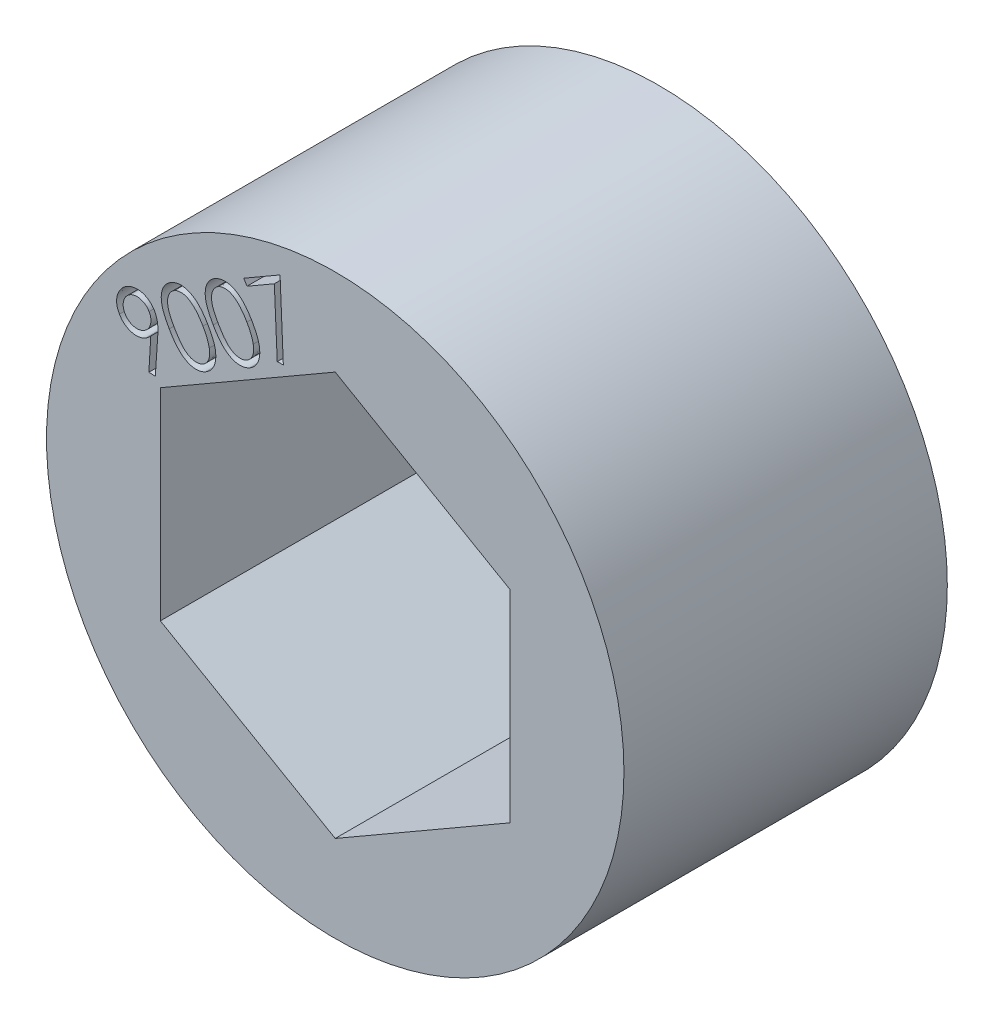
from build123d import *

# Parameters (mm, degrees)
SKETCH1_R           = 11.1125
BOSS_EXTRUDE1_DEPTH = 12.446
CUT_EXTRUDE1_DEPTH  = 2


with BuildPart() as part:
    # Sketch1 → Boss-Extrude1 (new body)
    with BuildSketch(Plane.XY):
        Circle(SKETCH1_R)
        Polygon((6.731, 3.886144662), (0, 7.772289324), (-6.731, 3.886144662), (-6.731, -3.886144662), (0, -7.772289324), (6.731, -3.886144662), align=None, mode=Mode.SUBTRACT)
    extrude(amount=BOSS_EXTRUDE1_DEPTH)

    # Sketch2 → Cut-Extrude1 (cut)
    # profile 1 of 4: a face of its own
    with BuildSketch(Plane.XY.offset(12.446)):
        with BuildLine():
            Line((-6.924573237, 4.169554117), (-7.172365705, 4.181765656))
            Line((-7.172365705, 4.181765656), (-7.099096474, 5.424798508))
            add(Edge.make_bspline(
                [(-7.099096474, 5.424798508), (-7.115082491, 5.407369556), (-7.146178835, 5.373466383), (-7.196679552, 5.328749615), (-7.247249931, 5.28893276), (-7.283061917, 5.267076576), (-7.300586859, 5.25638104)],
                knots=[0, 0, 0, 0, 1.07557127, 2.092224476, 3.066411598, 4, 4, 4, 4], degree=3))
            add(Edge.make_bspline(
                [(-7.300586859, 5.25638104), (-7.322245392, 5.244562458), (-7.365097755, 5.221178871), (-7.432394268, 5.194463627), (-7.500523976, 5.17467734), (-7.5697037, 5.163292848), (-7.639544965, 5.157833849), (-7.710525739, 5.160562601), (-7.782232964, 5.170921978), (-7.854086187, 5.188195988), (-7.924350337, 5.211812561), (-7.991348699, 5.241942907), (-8.054290519, 5.278203693), (-8.112922484, 5.320700807), (-8.167757247, 5.368767428), (-8.218277127, 5.422903097), (-8.264381974, 5.483418603), (-8.291278489, 5.527163849), (-8.304985897, 5.549457963)],
                knots=[0, 0, 0, 0, 1.015135184, 2.008489705, 2.974464217, 3.930823522, 4.890110555, 5.854468119, 6.84900024, 7.868689235, 8.893387844, 9.896732215, 10.888539014, 11.878968029, 12.873598221, 13.886496971, 14.922884625, 16, 16, 16, 16], degree=3))
            add(Edge.make_bspline(
                [(-8.304985897, 5.549457963), (-8.321829372, 5.580937848), (-8.35496852, 5.642873798), (-8.388523348, 5.74147864), (-8.41038059, 5.841169826), (-8.416390713, 5.942269443), (-8.410354933, 6.043160996), (-8.3888868, 6.142193846), (-8.354424656, 6.238857598), (-8.306747334, 6.331822917), (-8.247413823, 6.418819647), (-8.178679286, 6.497913682), (-8.099373913, 6.566649861), (-8.040250165, 6.603786522), (-8.010382532, 6.622546906)],
                knots=[0, 0, 0, 0, 1.035324533, 2.036977218, 3.013660684, 3.991039457, 4.968418229, 5.940283026, 6.923354643, 7.941094773, 8.965736768, 9.974485588, 10.976767849, 12, 12, 12, 12], degree=3))
            add(Edge.make_bspline(
                [(-8.010382532, 6.622546906), (-7.979910899, 6.638850823), (-7.919650887, 6.671093082), (-7.822977976, 6.703912105), (-7.723620108, 6.724036171), (-7.622366935, 6.731027877), (-7.521005812, 6.725244635), (-7.42209833, 6.705076571), (-7.326179688, 6.671818439), (-7.23552206, 6.624246651), (-7.150604524, 6.566583058), (-7.074244034, 6.499137059), (-7.007686175, 6.422178737), (-6.971693304, 6.364911211), (-6.953575641, 6.336084566)],
                knots=[0, 0, 0, 0, 1.019400264, 2.015942902, 3.002372847, 4.006779929, 5.005536382, 5.991966327, 6.979044859, 7.994053264, 9.007032045, 10.004279611, 10.995418019, 12, 12, 12, 12], degree=3))
            add(Edge.make_bspline(
                [(-6.953575641, 6.336084566), (-6.94108065, 6.31272698), (-6.915652645, 6.265192989), (-6.885381609, 6.188386689), (-6.861133323, 6.106084415), (-6.845411218, 6.033562631), (-6.836154063, 5.971895301), (-6.830329714, 5.921683006), (-6.827289712, 5.867998445), (-6.824338922, 5.810852315), (-6.824147449, 5.750433103), (-6.825154461, 5.686480995), (-6.8276696, 5.619128602), (-6.830514546, 5.573027762), (-6.831969071, 5.549457963)],
                knots=[0, 0, 0, 0, 1.179517641, 2.400384276, 3.669978525, 4.99951221, 5.702757638, 6.447991837, 7.250775919, 8.098000084, 8.997311831, 9.942054579, 10.947842213, 12, 12, 12, 12], degree=3))
            Line((-6.831969071, 5.549457963), (-6.924573237, 4.169554117))
        make_face()
        with BuildLine():
            add(Edge.make_bspline(
                [(-7.361135737, 5.478223989), (-7.345487269, 5.487746706), (-7.314754829, 5.50644862), (-7.272925048, 5.539525135), (-7.234809529, 5.575039337), (-7.201759778, 5.61461068), (-7.172554575, 5.656996981), (-7.147610177, 5.702548092), (-7.126426025, 5.751143971), (-7.110705102, 5.802616363), (-7.0986576, 5.855119612), (-7.092896712, 5.907849387), (-7.090958642, 5.959787747), (-7.095079997, 6.011179891), (-7.105043932, 6.061513312), (-7.119192538, 6.111409675), (-7.139177576, 6.16045437), (-7.156127013, 6.191897442), (-7.164733494, 6.207863412)],
                knots=[0, 0, 0, 0, 1.045108442, 2.052516081, 3.039037663, 4.014948609, 4.990090363, 5.974041511, 6.976128051, 8.011453109, 9.043011603, 10.047295345, 11.035574291, 12.007150616, 12.98344593, 13.961229243, 14.964765542, 16, 16, 16, 16], degree=3))
            add(Edge.make_bspline(
                [(-7.164733494, 6.207863412), (-7.174089133, 6.223337647), (-7.192579766, 6.25392117), (-7.225361936, 6.295555785), (-7.261221691, 6.333165381), (-7.300583692, 6.366255071), (-7.343021549, 6.395378721), (-7.388421649, 6.420501289), (-7.437279658, 6.440887199), (-7.48859131, 6.45687647), (-7.541170457, 6.468569984), (-7.59379444, 6.475439698), (-7.645815305, 6.476342459), (-7.697101746, 6.472242177), (-7.747829859, 6.463193366), (-7.797786368, 6.448045864), (-7.847496015, 6.428546419), (-7.87894757, 6.411079557), (-7.894881731, 6.402230399)],
                knots=[0, 0, 0, 0, 1.031712043, 2.039092063, 3.018573684, 3.994457873, 4.969572892, 5.953497063, 6.951758218, 7.98705489, 9.018585102, 10.024008046, 11.012022604, 11.983572292, 12.958061913, 13.947831088, 14.960318852, 16, 16, 16, 16], degree=3))
            add(Edge.make_bspline(
                [(-7.894881731, 6.402230399), (-7.910388278, 6.392913988), (-7.940921187, 6.374569665), (-7.982097239, 6.341251164), (-8.020219854, 6.305954392), (-8.053196364, 6.26632484), (-8.082544826, 6.224113666), (-8.106768331, 6.178261226), (-8.128105712, 6.129841495), (-8.143774813, 6.078340812), (-8.155836626, 6.025845148), (-8.161573927, 5.973282237), (-8.163530138, 5.921515103), (-8.159407983, 5.870292051), (-8.149447912, 5.819958724), (-8.135298263, 5.770062336), (-8.115313509, 5.721017647), (-8.098364033, 5.689574574), (-8.089757532, 5.673608604)],
                knots=[0, 0, 0, 0, 1.034021631, 2.036022986, 3.024725885, 4.002794686, 4.980092595, 5.961574923, 6.965877195, 8.00349148, 9.037330872, 10.043835206, 11.024597356, 11.998321951, 12.97677597, 13.956721278, 14.962476515, 16, 16, 16, 16], degree=3))
            add(Edge.make_bspline(
                [(-8.089757532, 5.673608604), (-8.080402299, 5.658133752), (-8.061912467, 5.627549009), (-8.029124446, 5.585923294), (-7.993286198, 5.548280986), (-7.953951832, 5.515402013), (-7.911936753, 5.485891939), (-7.866435331, 5.461124337), (-7.817859582, 5.439909893), (-7.766381593, 5.424197392), (-7.713879847, 5.412147629), (-7.661149682, 5.406387328), (-7.609211423, 5.404449106), (-7.557819252, 5.4085705), (-7.507485838, 5.418534425), (-7.457589474, 5.432683034), (-7.408544779, 5.452668071), (-7.377101707, 5.469617508), (-7.361135737, 5.478223989)],
                knots=[0, 0, 0, 0, 1.033571637, 2.042767394, 3.024014467, 4.001657624, 4.970548117, 5.956245748, 6.96011096, 7.997273687, 9.030663166, 10.03672948, 11.026762591, 12.000063433, 12.97809164, 13.957610489, 14.962928033, 16, 16, 16, 16], degree=3))
        make_face(mode=Mode.SUBTRACT)
    # profile 2 of 4: a face of its own
    with BuildSketch(Plane.XY.offset(12.446)):
        with BuildLine():
            add(Edge.make_bspline(
                [(-6.389027288, 6.017566938), (-6.409133435, 6.05287131), (-6.448236952, 6.121533154), (-6.500873973, 6.223940657), (-6.5479921, 6.321471948), (-6.588289918, 6.414639381), (-6.622135347, 6.503195954), (-6.649104818, 6.587324729), (-6.670478205, 6.66685528), (-6.684728435, 6.74258894), (-6.693459759, 6.815023383), (-6.697441648, 6.88469611), (-6.697696161, 6.952166749), (-6.693111178, 7.017469604), (-6.684045888, 7.080591596), (-6.670272779, 7.141511165), (-6.651816049, 7.200122602), (-6.629460311, 7.256615341), (-6.6032926, 7.310614152), (-6.572189244, 7.360976223), (-6.539018056, 7.4090837), (-6.501460957, 7.453283246), (-6.461212994, 7.495043123), (-6.416749354, 7.532866127), (-6.369393739, 7.568459362), (-6.335448189, 7.58906299), (-6.318302128, 7.599469982)],
                knots=[0, 0, 0, 0, 1.642217524, 3.193873097, 4.653599743, 6.020219012, 7.296149585, 8.484364078, 9.590266645, 10.622995624, 11.596731579, 12.537641419, 13.442669779, 14.322439731, 15.181528583, 16.018162769, 16.844365298, 17.663022962, 18.472528165, 19.266229043, 20.053716379, 20.832379209, 21.608138827, 22.395685855, 23.18965321, 24, 24, 24, 24], degree=3))
            add(Edge.make_bspline(
                [(-6.318302128, 7.599469982), (-6.300474489, 7.609271708), (-6.265131437, 7.628703497), (-6.209787585, 7.652335356), (-6.154045959, 7.672499617), (-6.096960794, 7.687280903), (-6.039102527, 7.697404539), (-5.980071677, 7.703057454), (-5.920188094, 7.704033863), (-5.859484113, 7.700372492), (-5.798152383, 7.692430856), (-5.736739105, 7.678593604), (-5.675517251, 7.65940816), (-5.613945721, 7.636279306), (-5.553264257, 7.606380908), (-5.492313163, 7.572026405), (-5.431183668, 7.533035334), (-5.370608651, 7.487827675), (-5.309343602, 7.437200437), (-5.248722903, 7.379183566), (-5.187834446, 7.314197984), (-5.127591655, 7.241999672), (-5.067536628, 7.162618397), (-5.006762535, 7.076751546), (-4.947049745, 6.983043093), (-4.908357548, 6.917603706), (-4.8885345, 6.884077354)],
                knots=[0, 0, 0, 0, 0.815881076, 1.617473213, 2.411751612, 3.192532544, 3.980223438, 4.766442947, 5.569622482, 6.380892254, 7.204795063, 8.048528362, 8.903143009, 9.777765604, 10.684831081, 11.614241792, 12.584586996, 13.591843045, 14.645331516, 15.771781295, 16.956234458, 18.217113798, 19.542884518, 20.949560407, 22.437178076, 24, 24, 24, 24], degree=3))
            add(Edge.make_bspline(
                [(-4.8885345, 6.884077354), (-4.869530652, 6.850255126), (-4.832467548, 6.784291814), (-4.781234767, 6.686184653), (-4.737228342, 6.591081689), (-4.698597399, 6.499763578), (-4.666653096, 6.411920287), (-4.640306006, 6.327614929), (-4.620396404, 6.246737064), (-4.6063935, 6.169055221), (-4.598603188, 6.094211015), (-4.593971274, 6.022202966), (-4.595400477, 5.952523966), (-4.599979685, 5.885128312), (-4.610491525, 5.820080305), (-4.624506818, 5.757237794), (-4.643374509, 5.696973407), (-4.666941719, 5.639407798), (-4.694183707, 5.584543463), (-4.725674846, 5.533004056), (-4.759484853, 5.483999185), (-4.797252883, 5.438330896), (-4.839447463, 5.396814623), (-4.883987575, 5.35750714), (-4.93219409, 5.321382207), (-4.966703412, 5.300529969), (-4.984191551, 5.289962771)],
                knots=[0, 0, 0, 0, 1.558572261, 3.039675171, 4.44500239, 5.767404933, 7.021920233, 8.19867626, 9.314183841, 10.366093107, 11.366862767, 12.335955634, 13.262731656, 14.164729598, 15.047477431, 15.907015182, 16.749641984, 17.580952634, 18.403702246, 19.207672054, 20.005351578, 20.794016824, 21.584181799, 22.380929523, 23.179510693, 24, 24, 24, 24], degree=3))
            add(Edge.make_bspline(
                [(-4.984191551, 5.289962771), (-5.001707815, 5.280398375), (-5.036487948, 5.261407397), (-5.090424565, 5.237293305), (-5.145760575, 5.218713906), (-5.201565282, 5.203563548), (-5.258522917, 5.194204812), (-5.316138998, 5.188366749), (-5.374836605, 5.187510596), (-5.434253982, 5.19085035), (-5.493895069, 5.199844146), (-5.553639391, 5.212682554), (-5.612762156, 5.232078045), (-5.672049751, 5.255375395), (-5.731144466, 5.284104522), (-5.790200814, 5.31763903), (-5.848795364, 5.35668413), (-5.907832517, 5.400497199), (-5.966485881, 5.451344089), (-6.025807257, 5.50924311), (-6.085659079, 5.574770443), (-6.145595752, 5.648407462), (-6.206315193, 5.729467377), (-6.266921655, 5.818563605), (-6.328918742, 5.914869108), (-6.368587219, 5.982644272), (-6.389027288, 6.017566938)],
                knots=[0, 0, 0, 0, 0.807491903, 1.603348545, 2.386916451, 3.167713854, 3.940658363, 4.719915701, 5.50935356, 6.313835313, 7.125313705, 7.947948844, 8.783651521, 9.640150085, 10.524255013, 11.440287308, 12.386399569, 13.372019105, 14.413529699, 15.525036669, 16.724996316, 18.002813491, 19.365932914, 20.822335035, 22.362637201, 24, 24, 24, 24], degree=3))
        make_face()
        with BuildLine():
            add(Edge.make_bspline(
                [(-6.178887064, 6.133067739), (-6.161426429, 6.103110337), (-6.127615012, 6.045099717), (-6.075562681, 5.962541829), (-6.024679761, 5.886803909), (-5.975569273, 5.817418966), (-5.927311523, 5.755166928), (-5.879859047, 5.700199785), (-5.834156819, 5.65148208), (-5.789064755, 5.609378951), (-5.744235972, 5.572833103), (-5.699427311, 5.540619065), (-5.654149077, 5.512669859), (-5.608806841, 5.488586996), (-5.563034266, 5.468596404), (-5.517073037, 5.452114899), (-5.470451641, 5.440634387), (-5.40939359, 5.4296989), (-5.334415628, 5.425511888), (-5.247777632, 5.434167276), (-5.165788161, 5.45555361), (-5.1162741, 5.480855148), (-5.091551326, 5.493488412)],
                knots=[0, 0, 0, 0, 1.475228016, 2.856686104, 4.15161897, 5.357081144, 6.47289893, 7.501387829, 8.445726694, 9.313720896, 10.124066195, 10.905058304, 11.660046733, 12.386348828, 13.08755313, 13.783651734, 14.460982071, 15.127735434, 16.421461315, 17.639985157, 18.821625413, 20, 20, 20, 20], degree=3))
            add(Edge.make_bspline(
                [(-5.091551326, 5.493488412), (-5.068050045, 5.508642633), (-5.021313431, 5.538779584), (-4.961478465, 5.598510023), (-4.911472366, 5.668409922), (-4.878039915, 5.734188546), (-4.85741428, 5.791297255), (-4.844382179, 5.836586753), (-4.836028368, 5.884173817), (-4.830714321, 5.933481805), (-4.830160258, 5.98468181), (-4.831895448, 6.037724108), (-4.838141277, 6.092619979), (-4.844899008, 6.129541753), (-4.848338185, 6.148332162)],
                knots=[0, 0, 0, 0, 1.342886321, 2.670576022, 4.038999414, 5.466462105, 6.205051725, 6.959707281, 7.731476591, 8.527516338, 9.344012544, 10.193626534, 11.080691652, 12, 12, 12, 12], degree=3))
            add(Edge.make_bspline(
                [(-4.848338185, 6.148332162), (-4.853141463, 6.172143603), (-4.862917253, 6.220605433), (-4.883241578, 6.293308409), (-4.907130982, 6.367897796), (-4.935515036, 6.443785885), (-4.968511178, 6.52100751), (-5.005013452, 6.599902304), (-5.046232724, 6.680377927), (-5.076591587, 6.733750011), (-5.092060141, 6.760944341)],
                knots=[0, 0, 0, 0, 0.879876913, 1.790754508, 2.73331625, 3.717259664, 4.725112015, 5.77538776, 6.866507818, 8, 8, 8, 8], degree=3))
            add(Edge.make_bspline(
                [(-5.092060141, 6.760944341), (-5.10779362, 6.787870192), (-5.138577546, 6.840552969), (-5.187171406, 6.915532581), (-5.23481293, 6.986156956), (-5.283133724, 7.051404219), (-5.332035694, 7.111199826), (-5.38028546, 7.166630757), (-5.429164096, 7.216445862), (-5.478121542, 7.261411746), (-5.526964594, 7.301536188), (-5.575131793, 7.337407737), (-5.623421228, 7.368040967), (-5.671156297, 7.394770451), (-5.718883008, 7.416498809), (-5.766067149, 7.4341661), (-5.813070596, 7.44701248), (-5.874327029, 7.457455208), (-5.948859172, 7.461753569), (-6.034923974, 7.45390492), (-6.116120824, 7.432318475), (-6.165175383, 7.407346344), (-6.18957216, 7.394926713)],
                knots=[0, 0, 0, 0, 1.327522451, 2.597413504, 3.803087542, 4.954092809, 6.052504639, 7.091116491, 8.08170511, 9.022070092, 9.919800897, 10.771882377, 11.577119672, 12.352806521, 13.099205072, 13.807429758, 14.495830891, 15.170113202, 16.450227669, 17.661618134, 18.837030004, 20, 20, 20, 20], degree=3))
            add(Edge.make_bspline(
                [(-6.18957216, 7.394926713), (-6.213108079, 7.379804023), (-6.260014083, 7.349665196), (-6.319558549, 7.289176728), (-6.370592085, 7.218882513), (-6.403603294, 7.151837696), (-6.425564344, 7.09426742), (-6.437351048, 7.048251661), (-6.446735168, 7.000730481), (-6.452444929, 6.951215807), (-6.453496603, 6.89985207), (-6.452395294, 6.846792003), (-6.446212657, 6.792159865), (-6.43786597, 6.735131452), (-6.424338023, 6.674922828), (-6.405316357, 6.610738959), (-6.38059286, 6.542128376), (-6.351092592, 6.468717826), (-6.315846632, 6.391109635), (-6.275361547, 6.308870657), (-6.229827267, 6.222012401), (-6.196212479, 6.163318957), (-6.178887064, 6.133067739)],
                knots=[0, 0, 0, 0, 1.186584607, 2.364808541, 3.584028067, 4.867913378, 5.52979883, 6.201670858, 6.884946004, 7.589109066, 8.317961587, 9.068444384, 9.84432244, 10.65432116, 11.518850237, 12.466086659, 13.499587148, 14.619373863, 15.830028341, 17.123623296, 18.517485242, 20, 20, 20, 20], degree=3))
        make_face(mode=Mode.SUBTRACT)
    # profile 3 of 4: a face of its own
    with BuildSketch(Plane.XY.offset(12.446)):
        with BuildLine():
            add(Edge.make_bspline(
                [(-4.696946884, 6.994490014), (-4.71705303, 7.029794386), (-4.756156547, 7.098456231), (-4.808793569, 7.200863734), (-4.855911696, 7.298395024), (-4.896209514, 7.391562458), (-4.930054943, 7.480119031), (-4.957024413, 7.564247806), (-4.9783978, 7.643778357), (-4.992648031, 7.719512017), (-5.001379354, 7.79194646), (-5.005361243, 7.861619187), (-5.005615756, 7.929089826), (-5.001030774, 7.994392681), (-4.991965484, 8.057514673), (-4.978192374, 8.118434241), (-4.959735644, 8.177045679), (-4.937379907, 8.233538418), (-4.911212196, 8.287537229), (-4.880108839, 8.337899299), (-4.846937652, 8.386006777), (-4.809380553, 8.430206323), (-4.769132589, 8.4719662), (-4.72466895, 8.509789204), (-4.677313335, 8.545382439), (-4.643367784, 8.565986067), (-4.626221723, 8.576393059)],
                knots=[0, 0, 0, 0, 1.642217524, 3.193873097, 4.653599743, 6.020219012, 7.296149585, 8.484364078, 9.590266645, 10.622995624, 11.596731579, 12.537641419, 13.442669779, 14.322439731, 15.181528583, 16.018162769, 16.844365298, 17.663022962, 18.472528165, 19.266229043, 20.053716379, 20.832379209, 21.608138827, 22.395685855, 23.18965321, 24, 24, 24, 24], degree=3))
            add(Edge.make_bspline(
                [(-4.626221723, 8.576393059), (-4.608394085, 8.586194785), (-4.573051033, 8.605626574), (-4.517707181, 8.629258433), (-4.461965555, 8.649422694), (-4.404880389, 8.66420398), (-4.347022123, 8.674327616), (-4.287991273, 8.679980531), (-4.22810769, 8.68095694), (-4.167403709, 8.677295569), (-4.106071979, 8.669353933), (-4.0446587, 8.655516681), (-3.983436846, 8.636331237), (-3.921865317, 8.613202383), (-3.861183853, 8.583303985), (-3.800232759, 8.548949482), (-3.739103264, 8.509958411), (-3.678528247, 8.464750752), (-3.617263198, 8.414123514), (-3.556642499, 8.356106643), (-3.495754042, 8.291121061), (-3.43551125, 8.218922749), (-3.375456224, 8.139541474), (-3.314682131, 8.053674623), (-3.254969341, 7.95996617), (-3.216277144, 7.894526783), (-3.196454095, 7.861000431)],
                knots=[0, 0, 0, 0, 0.815881076, 1.617473213, 2.411751612, 3.192532544, 3.980223438, 4.766442947, 5.569622482, 6.380892254, 7.204795063, 8.048528362, 8.903143009, 9.777765604, 10.684831081, 11.614241792, 12.584586996, 13.591843045, 14.645331516, 15.771781295, 16.956234458, 18.217113798, 19.542884518, 20.949560407, 22.437178076, 24, 24, 24, 24], degree=3))
            add(Edge.make_bspline(
                [(-3.196454095, 7.861000431), (-3.177450247, 7.827178203), (-3.140387144, 7.761214891), (-3.089154363, 7.66310773), (-3.045147938, 7.568004765), (-3.006516995, 7.476686655), (-2.974572692, 7.388843364), (-2.948225601, 7.304538006), (-2.928315999, 7.223660141), (-2.914313096, 7.145978298), (-2.906522783, 7.071134092), (-2.90189087, 6.999126042), (-2.903320072, 6.929447043), (-2.907899281, 6.862051389), (-2.918411121, 6.797003382), (-2.932426414, 6.734160871), (-2.951294105, 6.673896484), (-2.974861315, 6.616330875), (-3.002103303, 6.56146654), (-3.033594442, 6.509927133), (-3.067404448, 6.460922262), (-3.105172479, 6.415253973), (-3.147367059, 6.3737377), (-3.191907171, 6.334430217), (-3.240113685, 6.298305283), (-3.274623007, 6.277453046), (-3.292111146, 6.266885848)],
                knots=[0, 0, 0, 0, 1.558572261, 3.039675171, 4.44500239, 5.767404933, 7.021920233, 8.19867626, 9.314183841, 10.366093107, 11.366862767, 12.335955634, 13.262731656, 14.164729598, 15.047477431, 15.907015182, 16.749641984, 17.580952634, 18.403702246, 19.207672054, 20.005351578, 20.794016824, 21.584181799, 22.380929523, 23.179510693, 24, 24, 24, 24], degree=3))
            add(Edge.make_bspline(
                [(-3.292111146, 6.266885848), (-3.30962741, 6.257321452), (-3.344407543, 6.238330474), (-3.398344161, 6.214216382), (-3.45368017, 6.195636983), (-3.509484877, 6.180486625), (-3.566442512, 6.171127889), (-3.624058593, 6.165289826), (-3.682756201, 6.164433673), (-3.742173577, 6.167773427), (-3.801814665, 6.176767223), (-3.861558986, 6.189605631), (-3.920681752, 6.209001121), (-3.979969346, 6.232298472), (-4.039064062, 6.261027599), (-4.098120409, 6.294562107), (-4.15671496, 6.333607207), (-4.215752113, 6.377420276), (-4.274405477, 6.428267166), (-4.333726852, 6.486166187), (-4.393578674, 6.55169352), (-4.453515348, 6.625330539), (-4.514234788, 6.706390454), (-4.57484125, 6.795486682), (-4.636838337, 6.891792185), (-4.676506815, 6.959567349), (-4.696946884, 6.994490014)],
                knots=[0, 0, 0, 0, 0.807491903, 1.603348545, 2.386916451, 3.167713854, 3.940658363, 4.719915701, 5.50935356, 6.313835313, 7.125313705, 7.947948844, 8.783651521, 9.640150085, 10.524255013, 11.440287308, 12.386399569, 13.372019105, 14.413529699, 15.525036669, 16.724996316, 18.002813491, 19.365932914, 20.822335035, 22.362637201, 24, 24, 24, 24], degree=3))
        make_face()
        with BuildLine():
            add(Edge.make_bspline(
                [(-4.486806659, 7.109990816), (-4.469346025, 7.080033414), (-4.435534607, 7.022022794), (-4.383482277, 6.939464906), (-4.332599357, 6.863726986), (-4.283488868, 6.794342043), (-4.235231119, 6.732090005), (-4.187778642, 6.677122862), (-4.142076415, 6.628405157), (-4.096984351, 6.586302028), (-4.052155568, 6.54975618), (-4.007346907, 6.517542142), (-3.962068673, 6.489592936), (-3.916726437, 6.465510073), (-3.870953862, 6.445519481), (-3.824992633, 6.429037976), (-3.778371237, 6.417557464), (-3.717313185, 6.406621977), (-3.642335224, 6.402434964), (-3.555697227, 6.411090353), (-3.473707757, 6.432476687), (-3.424193695, 6.457778225), (-3.399470922, 6.470411489)],
                knots=[0, 0, 0, 0, 1.475228016, 2.856686104, 4.15161897, 5.357081144, 6.47289893, 7.501387829, 8.445726694, 9.313720896, 10.124066195, 10.905058304, 11.660046733, 12.386348828, 13.08755313, 13.783651734, 14.460982071, 15.127735434, 16.421461315, 17.639985157, 18.821625413, 20, 20, 20, 20], degree=3))
            add(Edge.make_bspline(
                [(-3.399470922, 6.470411489), (-3.37596964, 6.48556571), (-3.329233027, 6.515702661), (-3.269398061, 6.5754331), (-3.219391961, 6.645332999), (-3.18595951, 6.711111623), (-3.165333876, 6.768220332), (-3.152301774, 6.81350983), (-3.143947963, 6.861096894), (-3.138633917, 6.910404882), (-3.138079853, 6.961604887), (-3.139815043, 7.014647185), (-3.146060872, 7.069543056), (-3.152818604, 7.10646483), (-3.156257781, 7.125255239)],
                knots=[0, 0, 0, 0, 1.342886321, 2.670576022, 4.038999414, 5.466462105, 6.205051725, 6.959707281, 7.731476591, 8.527516338, 9.344012544, 10.193626534, 11.080691652, 12, 12, 12, 12], degree=3))
            add(Edge.make_bspline(
                [(-3.156257781, 7.125255239), (-3.161061059, 7.14906668), (-3.170836848, 7.19752851), (-3.191161173, 7.270231486), (-3.215050577, 7.344820873), (-3.243434631, 7.420708962), (-3.276430774, 7.497930587), (-3.312933047, 7.576825381), (-3.35415232, 7.657301004), (-3.384511183, 7.710673088), (-3.399979736, 7.737867418)],
                knots=[0, 0, 0, 0, 0.879876913, 1.790754508, 2.73331625, 3.717259664, 4.725112015, 5.77538776, 6.866507818, 8, 8, 8, 8], degree=3))
            add(Edge.make_bspline(
                [(-3.399979736, 7.737867418), (-3.415713216, 7.764793269), (-3.446497141, 7.817476046), (-3.495091002, 7.892455658), (-3.542732526, 7.963080033), (-3.59105332, 8.028327296), (-3.639955289, 8.088122903), (-3.688205055, 8.143553834), (-3.737083692, 8.193368939), (-3.786041138, 8.238334823), (-3.83488419, 8.278459265), (-3.883051388, 8.314330813), (-3.931340824, 8.344964044), (-3.979075893, 8.371693527), (-4.026802604, 8.393421886), (-4.073986745, 8.411089176), (-4.120990191, 8.423935557), (-4.182246625, 8.434378284), (-4.256778767, 8.438676646), (-4.342843569, 8.430827997), (-4.42404042, 8.409241552), (-4.473094979, 8.384269421), (-4.497491755, 8.37184979)],
                knots=[0, 0, 0, 0, 1.327522451, 2.597413504, 3.803087542, 4.954092809, 6.052504639, 7.091116491, 8.08170511, 9.022070092, 9.919800897, 10.771882377, 11.577119672, 12.352806521, 13.099205072, 13.807429758, 14.495830891, 15.170113202, 16.450227669, 17.661618134, 18.837030004, 20, 20, 20, 20], degree=3))
            add(Edge.make_bspline(
                [(-4.497491755, 8.37184979), (-4.521027674, 8.3567271), (-4.567933678, 8.326588273), (-4.627478145, 8.266099805), (-4.678511681, 8.19580559), (-4.711522889, 8.128760773), (-4.73348394, 8.071190497), (-4.745270643, 8.025174737), (-4.754654764, 7.977653558), (-4.760364525, 7.928138884), (-4.761416198, 7.876775147), (-4.760314889, 7.82371508), (-4.754132252, 7.769082942), (-4.745785566, 7.712054529), (-4.732257619, 7.651845905), (-4.713235953, 7.587662036), (-4.688512455, 7.519051453), (-4.659012188, 7.445640903), (-4.623766228, 7.368032712), (-4.583281143, 7.285793734), (-4.537746863, 7.198935478), (-4.504132074, 7.140242033), (-4.486806659, 7.109990816)],
                knots=[0, 0, 0, 0, 1.186584607, 2.364808541, 3.584028067, 4.867913378, 5.52979883, 6.201670858, 6.884946004, 7.589109066, 8.317961587, 9.068444384, 9.84432244, 10.65432116, 11.518850237, 12.466086659, 13.499587148, 14.619373863, 15.830028341, 17.123623296, 18.517485242, 20, 20, 20, 20], degree=3))
        make_face(mode=Mode.SUBTRACT)
    # profile 4 of 4: a face of its own
    with BuildSketch(Plane.XY.offset(12.446)):
        Polygon((-3.517751095, 9.142194341), (-2.12309164, 9.94815588), (-1.997414556, 7.014333764), (-2.231977858, 7.00263104), (-2.34391696, 9.543648668), (-3.397670967, 8.934598188), align=None)
    extrude(amount=-CUT_EXTRUDE1_DEPTH, mode=Mode.SUBTRACT)


solid = part.part
